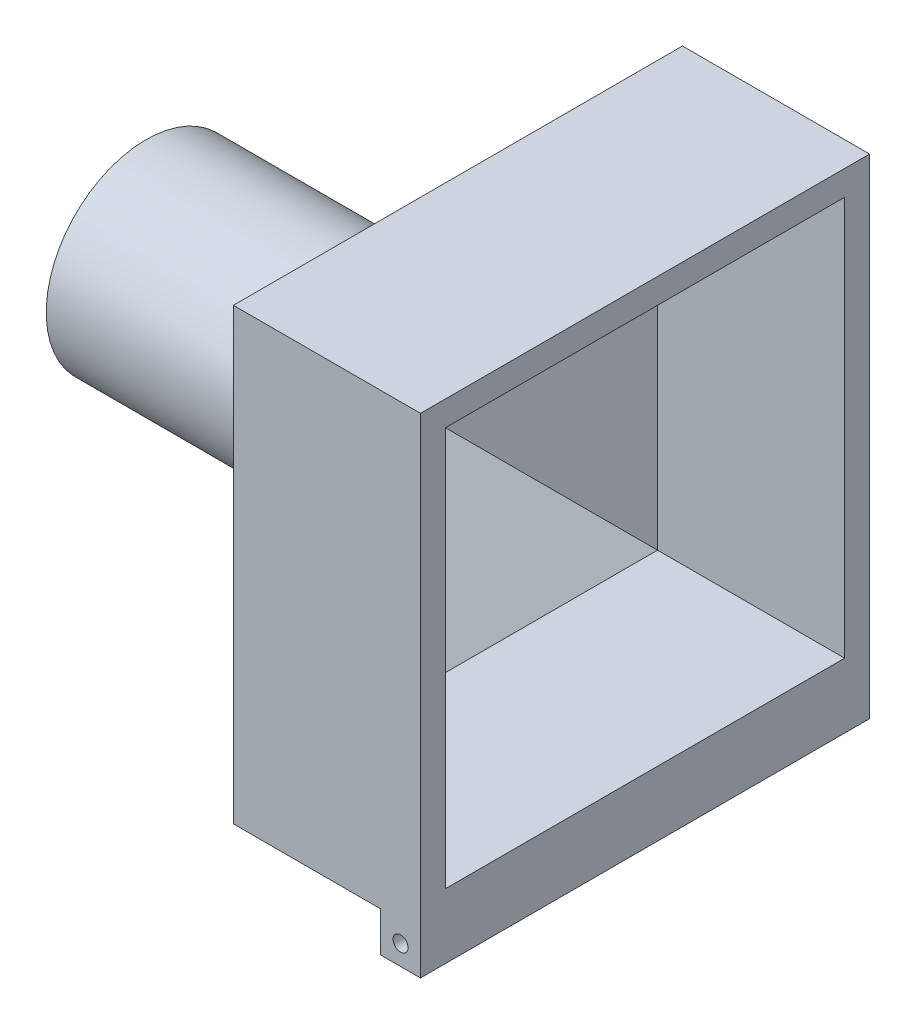
from build123d import *

# Parameters (mm, degrees)
SKETCH_1_R          = 8
SKETCH_1_R_2        = 7.6
EXTRUDE_1_DEPTH     = 15
SKETCH_4_W          = 16
SKETCH_4_H          = 16
EXTRUDE_3_DEPTH     = 10
EXTRUDE_3_TAPER     = -45
SKETCH_6_W          = 36
SKETCH_6_H          = 36
EXTRUDE_5_DEPTH     = 15
SKETCH_7_W          = 32
SKETCH_7_H          = 32
CUT_EXTRUDE_3_DEPTH = 15
SKETCH_8_W          = 32
SKETCH_8_H          = 32
CUT_EXTRUDE_6_DEPTH = 9.2
CUT_EXTRUDE_6_DRAFT = -45
SKETCH_9_R          = 7.6
CUT_EXTRUDE_7_DEPTH = 40
SKETCH_10_W         = 3.2
SKETCH_10_H         = 36
EXTRUDE_7_DEPTH     = 3.2
SKETCH_11_R         = 0.6
CUT_EXTRUDE_8_DEPTH = 36


with BuildPart() as part:
    # Эскиз1 → Бобышка-Вытянуть1 (new body)
    with BuildSketch(Plane(origin=(0, 0, 0), x_dir=(0, 0, -1), z_dir=(1, 0, 0))):
        Circle(SKETCH_1_R)
        Circle(SKETCH_1_R_2, mode=Mode.SUBTRACT)
    extrude(amount=EXTRUDE_1_DEPTH)

    # Эскиз4 → Бобышка-Вытянуть3 (add)
    with BuildSketch(Plane(origin=(15, 0, 0), x_dir=(0, 0, -1), z_dir=(1, 0, 0))):
        Rectangle(SKETCH_4_W, SKETCH_4_H)
    extrude(amount=EXTRUDE_3_DEPTH, taper=EXTRUDE_3_TAPER)

    # Эскиз6 → Бобышка-Вытянуть5 (add)
    with BuildSketch(Plane(origin=(25, 0, 0), x_dir=(0, 0, -1), z_dir=(1, 0, 0))):
        Rectangle(SKETCH_6_W, SKETCH_6_H)
    extrude(amount=EXTRUDE_5_DEPTH)

    # Эскиз7 → Вырез-Вытянуть3 (cut)
    with BuildSketch(Plane(origin=(40, 0, 0), x_dir=(0, 0, -1), z_dir=(1, 0, 0))):
        Rectangle(SKETCH_7_W, SKETCH_7_H)
    extrude(amount=-CUT_EXTRUDE_3_DEPTH, mode=Mode.SUBTRACT)


with BuildPart() as cut_extrude_6_tool:
    # Эскиз8 → Вырез-Вытянуть6 (with draft: the straight prism first)
    with BuildSketch(Plane(origin=(25, 0, 0), x_dir=(0, 0, -1), z_dir=(1, 0, 0))):
        Rectangle(SKETCH_8_W, SKETCH_8_H)
    extrude(amount=-CUT_EXTRUDE_6_DEPTH)
    # Вырез-Вытянуть6: the draft: its side faces are tilted about the plane it starts from
    cut_extrude_6_sides = [cut_extrude_6_tool.faces().sort_by_distance(p)[0] for p in [
        (20.4, -16, 0),
        (20.4, 0, -16),
        (20.4, 16, 0),
        (20.4, 0, 16),
    ]]
    draft(cut_extrude_6_sides, Plane(origin=(25, 0, 0), x_dir=(0, 0, -1), z_dir=(1, 0, 0)), CUT_EXTRUDE_6_DRAFT)


with BuildPart() as part_1:
    add(part.part)

    # Вырез-Вытянуть6: cut by cut_extrude_6_tool
    add(cut_extrude_6_tool.part, mode=Mode.SUBTRACT)

    # Эскиз9 → Вырез-Вытянуть7 (cut)
    with BuildSketch(Plane.ZY):
        with Locations(Location((0, 0, 0), (0, 0, 26.525352017))):
            Circle(SKETCH_9_R)
    extrude(amount=-CUT_EXTRUDE_7_DEPTH, mode=Mode.SUBTRACT)

    # Эскиз10 → Бобышка-Вытянуть7 (add)
    with BuildSketch(Plane.XZ.offset(18)):
        with Locations((38.4, 0)):
            Rectangle(SKETCH_10_W, SKETCH_10_H)
    extrude(amount=EXTRUDE_7_DEPTH)

    # Эскиз11 → Вырез-Вытянуть8 (cut)
    with BuildSketch(Plane(origin=(0, 0, -18), x_dir=(-1, 0, 0), z_dir=(0, 0, -1))):
        with Locations((-38.4, -19.6)):
            Circle(SKETCH_11_R)
    extrude(amount=-CUT_EXTRUDE_8_DEPTH, mode=Mode.SUBTRACT)


solid = part_1.part
